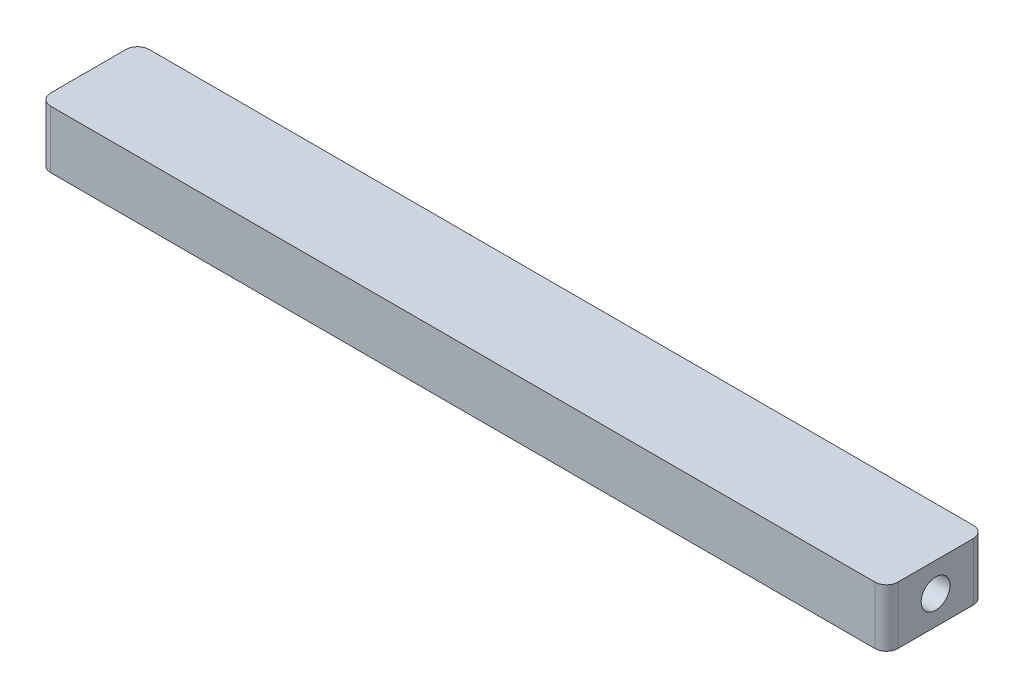
from build123d import *

# Parameters (mm, degrees)
Y_KSEKLIK_EKSTR_ZYON1_DEPTH = 10
IZIM2_R                     = 2.5
KES_EKSTR_ZYON1_DEPTH       = 170


with BuildPart() as part:
    # Çizim1 → Yükseklik-Ekstrüzyon1 (new body)
    with BuildSketch(Plane(origin=(0, 0, 0), x_dir=(1, 0, 0), z_dir=(0, 1, 0))):
        with BuildLine():
            Line((-48.769745033, 34.22514167), (94.301322779, 34.22514167))
            ThreePointArc((94.301322779, 34.22514167), (95.715536341, 33.639355233), (96.301322779, 32.22514167))
            Line((96.301322779, 32.22514167), (96.301322779, 19.154073858))
            ThreePointArc((96.301322779, 19.154073858), (95.715536341, 17.739860296), (94.301322779, 17.154073858))
            Line((94.301322779, 17.154073858), (-48.769745033, 17.154073858))
            ThreePointArc((-48.769745033, 17.154073858), (-50.183958595, 17.739860296), (-50.769745033, 19.154073858))
            Line((-50.769745033, 19.154073858), (-50.769745033, 32.22514167))
            ThreePointArc((-50.769745033, 32.22514167), (-50.183958595, 33.639355233), (-48.769745033, 34.22514167))
        make_face()
    extrude(amount=Y_KSEKLIK_EKSTR_ZYON1_DEPTH)

    # Çizim2 → Kes-Ekstrüzyon1 (cut)
    with BuildSketch(Plane(origin=(96.301322779, 0, 0), x_dir=(0, 0, -1), z_dir=(1, 0, 0))):
        with Locations((25.689607764, 5)):
            Circle(IZIM2_R)
    extrude(amount=-KES_EKSTR_ZYON1_DEPTH, mode=Mode.SUBTRACT)


solid = part.part
